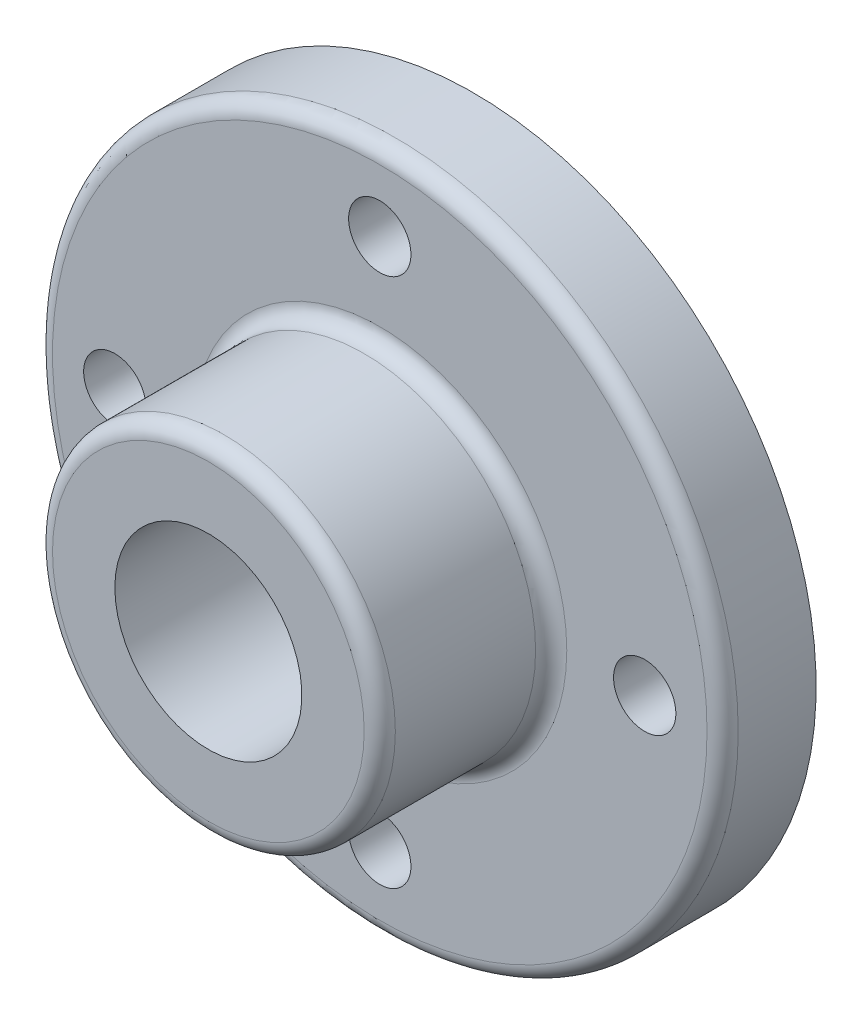
from build123d import *

# Parameters (mm, degrees)
D_GAGEMENT_22_D              = 12.7
R_P_TITION_CIRCULAIRE1_COUNT = 4
CONG_1_R                     = 3.175


with BuildPart() as part:
    # Esquisse1 → Base-Révolution (revolve)
    with BuildSketch(Plane(origin=(0, 0, 0), x_dir=(0, 0, -1), z_dir=(1, 0, 0)), mode=Mode.PRIVATE) as base_r_volution_sk:
        Polygon((0, 19.05), (0, 69.85), (-19.05, 69.85), (-19.05, 34.925), (-53.975, 34.925), (-53.975, 19.05), align=None)
    revolve(base_r_volution_sk.sketch.rotate(Axis((0, 0, 48.319469853), (0, 0, -1)), 270), axis=Axis((0, 0, 48.319469853), (0, 0, -1)))

    # Dégagement 22 (through all)
    with Locations(Plane.XY.offset(19.05)):
        with Locations((0, 53.975)):
            d_gagement_22 = Hole(D_GAGEMENT_22_D / 2)

    # Répétition circulaire1: Dégagement 22 ×4 about axis
    r_p_tition_circulaire1_axis = Axis((0, 0, 0), (0, 0, 1))
    for i in range(1, R_P_TITION_CIRCULAIRE1_COUNT):
        add(d_gagement_22.rotate(r_p_tition_circulaire1_axis, i * 360 / R_P_TITION_CIRCULAIRE1_COUNT), mode=Mode.SUBTRACT)

    # Congé1
    cong_1_edges = [part.edges().sort_by_distance(p)[0] for p in [
        (34.925, 0, 53.975),
        (34.925, 0, 19.05),
        (69.85, 0, 19.05),
    ]]
    fillet(cong_1_edges, radius=CONG_1_R)


solid = part.part
